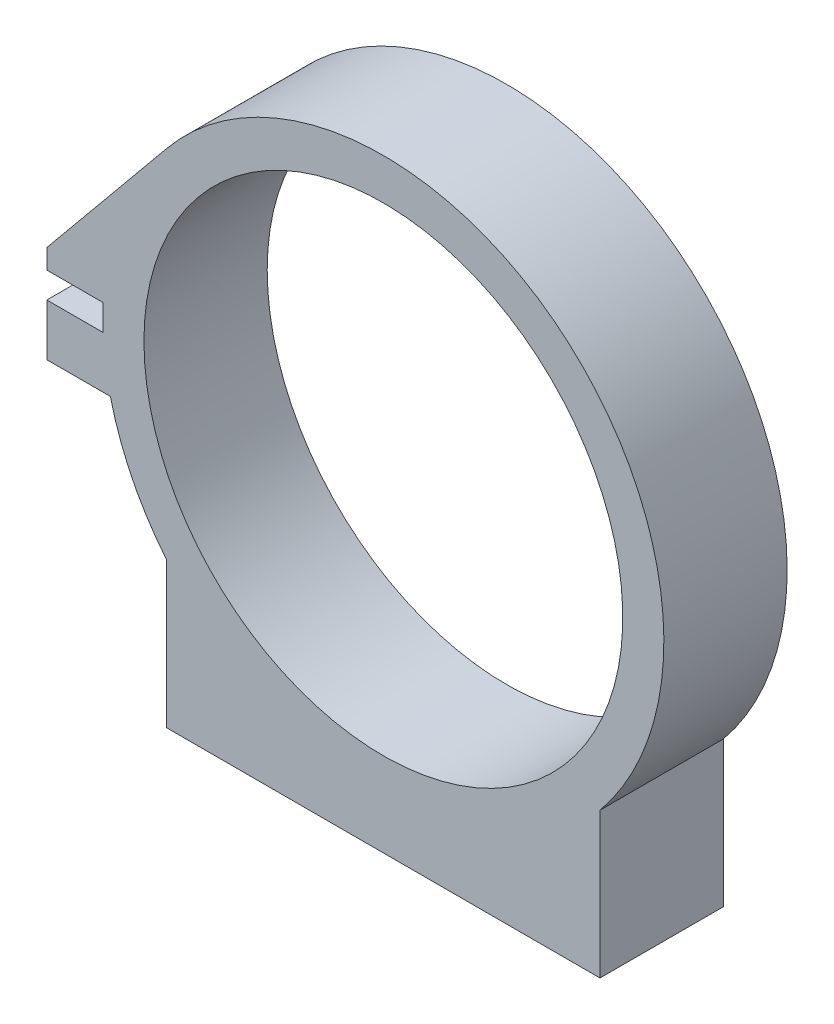
from build123d import *

# Parameters (mm, degrees)
SKETCH1_R           = 18.5
BOSS_EXTRUDE1_DEPTH = 9.525
SKETCH2_R           = 1.3890625
CUT_EXTRUDE1_DEPTH  = 6.35
CUT_EXTRUDE2_REACH  = 40.448
SKETCH3_R           = 1.3890625


with BuildPart() as part:
    # Sketch1 → Boss-Extrude1 (new body)
    with BuildSketch(Plane.XY):
        with BuildLine():
            Line((-16.7386, 13.770435543), (-26, 2.512776367))
            Line((-26, 2.512776367), (-26, 1))
            Line((-26, 1), (-21.651919661, 1))
            ThreePointArc((-21.651919661, 1), (-21.675, 0), (-21.651919661, -1))
            Line((-21.651919661, -1), (-26, -1))
            Line((-26, -1), (-26, -5))
            Line((-26, -5), (-21.090415477, -5))
            ThreePointArc((-21.090415477, -5), (-19.416197823, -9.634152122), (-16.7386, -13.770435543))
            Line((-16.7386, -13.770435543), (-16.7386, -25))
            Line((-16.7386, -25), (16.7386, -25))
            Line((16.7386, -25), (16.7386, -13.770435543))
            ThreePointArc((16.7386, -13.770435543), (13.770435543, 16.7386), (-16.7386, 13.770435543))
        make_face()
        with Locations(Location((0, 0, 0), (0, 0, 180))):
            Circle(SKETCH1_R, mode=Mode.SUBTRACT)
    extrude(amount=BOSS_EXTRUDE1_DEPTH)

    # Sketch2 → Cut-Extrude1 (cut)
    with BuildSketch(Plane.XZ.offset(25)):
        with Locations(Location((-13.4747, 4.7625, 0), (0, 0, 270))):
            Circle(SKETCH2_R)
        with Locations(Location((13.4747, 4.7625, 0), (0, 0, 270))):
            Circle(SKETCH2_R)
    extrude(amount=-CUT_EXTRUDE1_DEPTH, mode=Mode.SUBTRACT)

    # Cut-Extrude2: up to this plane
    cut_extrude2_end = Plane(origin=(-16.7386, 13.770435543, 9.525), z_dir=(0.7722537485582471, -0.635314211896551, 0))
    # Sketch3 → Cut-Extrude2 (cut, up to the surface)
    with BuildSketch(Plane.XZ.offset(5), mode=Mode.PRIVATE) as cut_extrude2_sk1:
        with Locations(Location((-23.545207739, 4.7625, 0), (0, 0, 180))):
            Circle(SKETCH3_R)
    cut_extrude2_tool1 = split(extrude(cut_extrude2_sk1.sketch, amount=-CUT_EXTRUDE2_REACH, mode=Mode.PRIVATE), bisect_by=cut_extrude2_end, keep=Keep.BOTH, mode=Mode.PRIVATE)
    add(cut_extrude2_tool1.solids().sort_by_distance((-23.545208, -5, 4.7625))[0], mode=Mode.SUBTRACT)


solid = part.part
